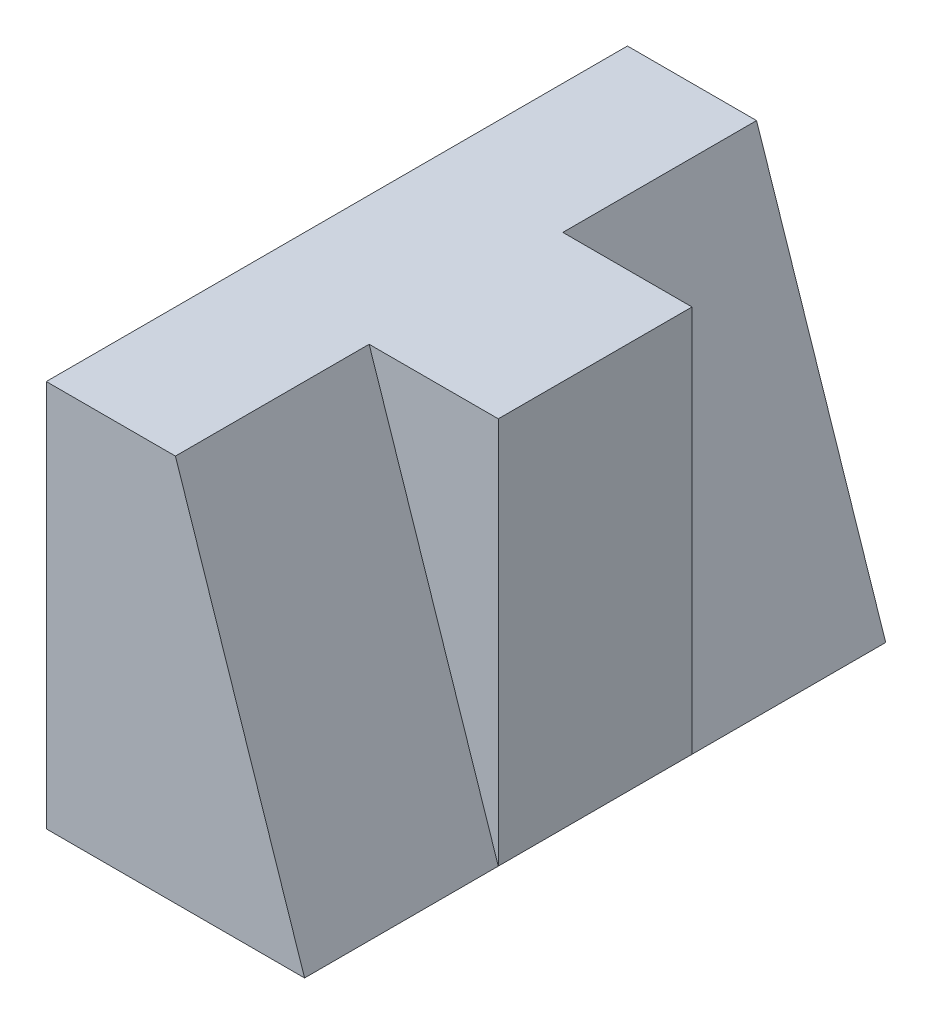
from build123d import *

# Parameters (mm, degrees)
BOSS_EXTRUDE1_DEPTH = 45
BOSS_EXTRUDE2_DEPTH = 15


with BuildPart() as part:
    # Sketch1 → Boss-Extrude1 (new, symmetric)
    with BuildSketch(Plane.XY):
        Polygon((40, 0), (20, 60), (0, 60), (0, 0), align=None)
    extrude(amount=BOSS_EXTRUDE1_DEPTH, both=True)

    # Sketch1<3> → Boss-Extrude2 (add, symmetric)
    with BuildSketch(Plane.XY):
        Polygon((40, 0), (40, 60), (20, 60), align=None)
    extrude(amount=BOSS_EXTRUDE2_DEPTH, both=True)


solid = part.part
